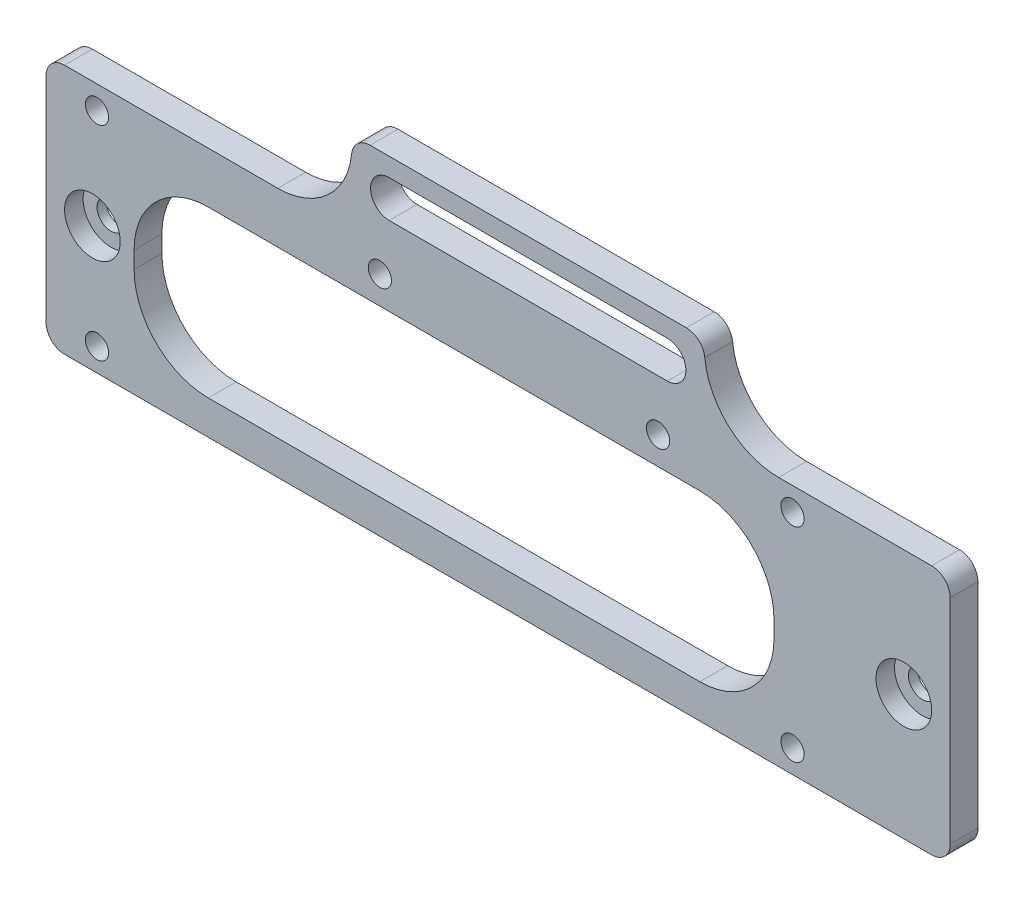
from build123d import *

# Parameters (mm, degrees)
SKETCH_3_W               = 97.5
SKETCH_3_H               = 27
EXTRUDE_1_DEPTH          = 3
SKETCH_4_R               = 1.25
CUT_EXTRUDE_1_DEPTH      = 51.673587795
SKETCH_7_W               = 4
SKETCH_7_H               = 8
EXTRUDE_2_DEPTH          = 5
SKETCH_8_W               = 38
SKETCH_8_H               = 9
EXTRUDE_3_DEPTH          = 3
FILLET_3_R               = 8
FILLET_4_R               = 2
CUT_EXTRUDE_4_DEPTH      = 55.284551355
CUT_EXTRUDE_4_DEPTH_BACK = 5
SKETCH_9_W               = 4
SKETCH_9_H               = 8
SKETCH_13_R              = 1.5
CUT_EXTRUDE_7_DEPTH      = 54.775575449
SKETCH_16_R              = 3
CUT_EXTRUDE_9_DEPTH      = 2
CUT_EXTRUDE_10_DEPTH     = 10
FILLET_5_R               = 8
FILLET_6_R               = 2
HOLE_WIZARD_M3_1_D       = 2.5
HOLE_WIZARD_M3_1_DEPTH   = 3
HOLE_WIZARD_M3_1_TIP     = 0.751075774


with BuildPart() as part:
    # 草图3 → 凸台-拉伸1 (new body)
    with BuildSketch(Plane.XY):
        Rectangle(SKETCH_3_W, SKETCH_3_H)
    extrude(amount=EXTRUDE_1_DEPTH)

    # 草图4 → 切除-拉伸1 (cut, through all)
    with BuildSketch(Plane.XY.offset(3)):
        with Locations((-43.25, 11)):
            Circle(SKETCH_4_R)
        with Locations((-43.25, -11)):
            Circle(SKETCH_4_R)
        with Locations((31.75, 11)):
            Circle(SKETCH_4_R)
        with Locations((31.75, -11)):
            Circle(SKETCH_4_R)
        with Locations((17.25, 11)):
            Circle(SKETCH_4_R)
        with Locations((-12.75, 11)):
            Circle(SKETCH_4_R)
    extrude(amount=-CUT_EXTRUDE_1_DEPTH, mode=Mode.SUBTRACT)

    # 草图7 → 凸台-拉伸2 (add)
    with BuildSketch(Plane(origin=(0, 0, 0), x_dir=(-1, 0, 0), z_dir=(0, 0, -1))):
        with Locations((46.75, 0.5)):
            Rectangle(SKETCH_7_W, SKETCH_7_H)
        with Locations((-46.75, 0.5)):
            Rectangle(SKETCH_7_W, SKETCH_7_H)
    extrude(amount=EXTRUDE_2_DEPTH)

    # 草图8 → 凸台-拉伸3 (add)
    with BuildSketch(Plane.XY.offset(3)):
        with Locations((3.25, 18)):
            Rectangle(SKETCH_8_W, SKETCH_8_H)
        with BuildLine():
            Line((-11.75, 20.5), (18.25, 20.5))
            ThreePointArc((18.25, 20.5), (20.25, 18.5), (18.25, 16.5))
            Line((18.25, 16.5), (-11.75, 16.5))
            ThreePointArc((-11.75, 16.5), (-13.75, 18.5), (-11.75, 20.5))
        make_face(mode=Mode.SUBTRACT)
    extrude(amount=-EXTRUDE_3_DEPTH)

    # 圆角3
    fillet_3_edges = [part.edges().sort_by_distance(p)[0] for p in [
        (22.25, 13.5, 1.5),
        (-15.75, 13.5, 1.5),
    ]]
    fillet(fillet_3_edges, radius=FILLET_3_R)

    # 圆角4
    fillet_4_edges = [part.edges().sort_by_distance(p)[0] for p in [
        (-15.75, 22.5, 1.5),
        (22.25, 22.5, 1.5),
    ]]
    fillet(fillet_4_edges, radius=FILLET_4_R)

    # 草图9 → 切除-拉伸4 (cut, two sides: drawn at the far end of the back side and taken through both)
    with BuildSketch(Plane(origin=(0, 0, -5), x_dir=(-1, 0, 0), z_dir=(0, 0, -1)).offset(-CUT_EXTRUDE_4_DEPTH_BACK)):
        with Locations((-46.75, 0.5)):
            Rectangle(SKETCH_9_W, SKETCH_9_H)
        with Locations((46.75, 0.5)):
            Rectangle(SKETCH_9_W, SKETCH_9_H)
    extrude(amount=CUT_EXTRUDE_4_DEPTH + CUT_EXTRUDE_4_DEPTH_BACK, mode=Mode.SUBTRACT)

    # 草图13 → 切除-拉伸7 (cut, through all)
    with BuildSketch(Plane(origin=(0, 0, 0), x_dir=(-1, 0, 0), z_dir=(0, 0, -1))):
        with Locations((-43.75, 0)):
            Circle(SKETCH_13_R)
        with Locations((43.75, 0)):
            Circle(SKETCH_13_R)
    extrude(amount=-CUT_EXTRUDE_7_DEPTH, mode=Mode.SUBTRACT)

    # 草图16 → 切除-拉伸9 (cut)
    with BuildSketch(Plane.XY.offset(3)):
        with Locations((-43.75, 0)):
            Circle(SKETCH_16_R)
        with Locations((43.75, 0)):
            Circle(SKETCH_16_R)
    extrude(amount=-CUT_EXTRUDE_9_DEPTH, mode=Mode.SUBTRACT)

    # 草图17 → 切除-拉伸10 (cut)
    with BuildSketch(Plane(origin=(0, 0, 0), x_dir=(-1, 0, 0), z_dir=(0, 0, -1))):
        Polygon((39.25, -8), (39.25, 8), (-27.75, 8), (-29.75, 8), (-29.75, -9.826666667), (-27.75, -9.826666667), (39.25, -9.826666667), align=None)
    extrude(amount=-CUT_EXTRUDE_10_DEPTH, mode=Mode.SUBTRACT)

    # 圆角5
    fillet_5_edges = [part.edges().sort_by_distance(p)[0] for p in [
        (29.75, 8, 1.5),
        (-39.25, 8, 1.5),
        (-39.25, -9.826666667, 1.5),
        (29.75, -9.826666667, 1.5),
    ]]
    fillet(fillet_5_edges, radius=FILLET_5_R)

    # 圆角6
    fillet_6_edges = [part.edges().sort_by_distance(p)[0] for p in [
        (48.75, -13.5, 1.5),
        (-48.75, -13.5, 1.5),
        (-48.75, 13.5, 1.5),
        (48.75, 13.5, 1.5),
    ]]
    fillet(fillet_6_edges, radius=FILLET_6_R)

    # M3 螺纹孔1
    with Locations(Plane(origin=(-43.25, 11, 3), x_dir=(1, 0, 0), z_dir=(0, 0, 1))):
        with Locations((0, 0), (0, -22), (30.5, 0), (60.5, 0), (75, 0), (75, -22)):
            Hole(HOLE_WIZARD_M3_1_D / 2, depth=HOLE_WIZARD_M3_1_DEPTH)
            with Locations((0, 0, -(HOLE_WIZARD_M3_1_DEPTH + HOLE_WIZARD_M3_1_TIP / 2))):  # 118° drill point
                Cone(0, HOLE_WIZARD_M3_1_D / 2, HOLE_WIZARD_M3_1_TIP, mode=Mode.SUBTRACT)


solid = part.part
